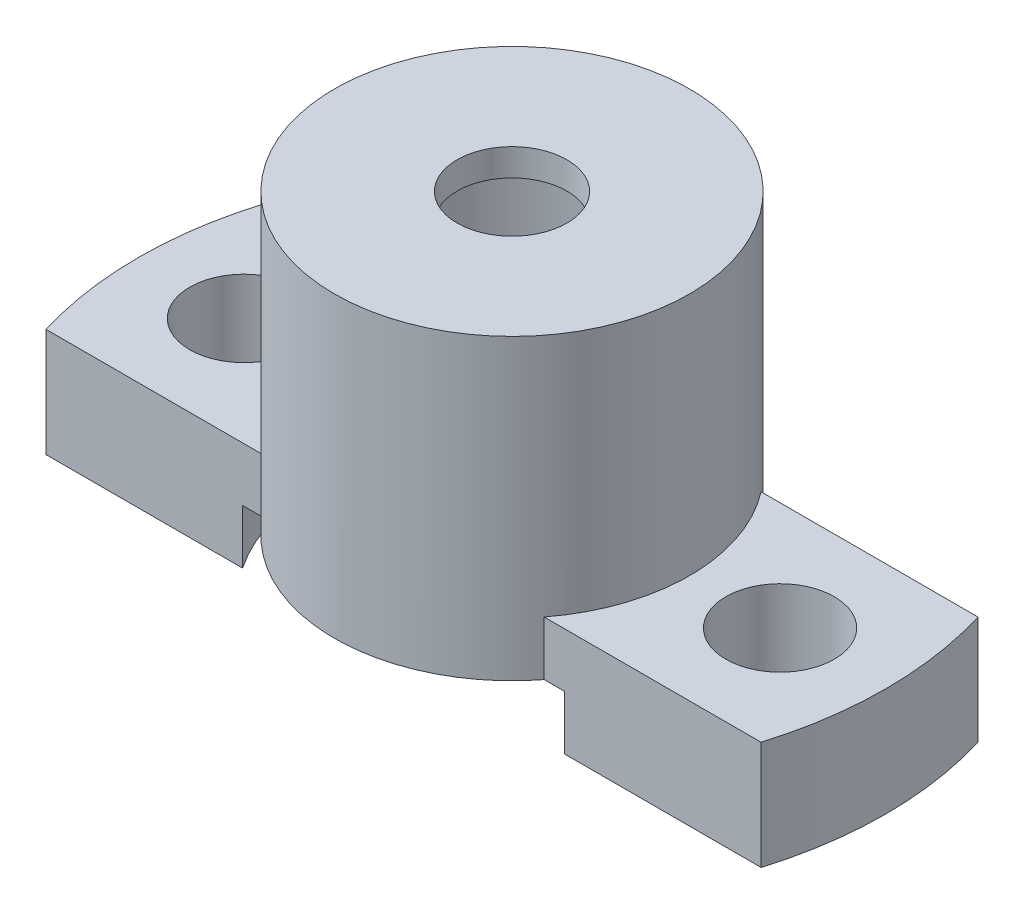
from build123d import *

# Parameters (mm, degrees)
SKETCH5_R                             = 6.55
SKETCH5_R_2                           = 2.025
EXT_TOPMAGNETROOM_DEPTH               = 1
EXT_MAGNETROOM_START                  = 4
SKETCH7_R                             = 6.55
SKETCH7_R_2                           = 5.05
EXT_MAGNETROOM_DEPTH                  = 4
BOTTOM_ARMS_FIXING_WITH_SUPPORT_DEPTH = 2
BOTTOM_START                          = 2
BOTTOM_FIXING_ARMS_END_DEPTH          = 2
ESQUISSE1_R                           = 2
EXT_HOLEMOUNTED_DEPTH                 = 16.773179512
SKETCH10_R                            = 6.55
SKETCH10_R_2                          = 5.05
CHAMBER_DEPTH                         = 5
SKETCH11_R                            = 6.55
SKETCH11_R_2                          = 2.025
BOSS_EXTRUDE4_DEPTH                   = 1
SKETCH13_R                            = 5.2
CUT_EXTRUDE2_DEPTH                    = 4


with BuildPart() as part:
    # Sketch5 → Ext_TopMagnetRoom (new body)
    with BuildSketch(Plane(origin=(0, 0, 0), x_dir=(-1, 0, 0), z_dir=(0, 1, 0))):
        with Locations(Location((0, 0, 0), (0, 0, 90))):
            Circle(SKETCH5_R)
        with Locations(Location((0, 0, 0), (0, 0, 90))):
            Circle(SKETCH5_R_2, mode=Mode.SUBTRACT)
    extrude(amount=EXT_TOPMAGNETROOM_DEPTH)

    # Sketch7 → Ext_MagnetRoom (add)
    with BuildSketch(Plane.XZ.offset(EXT_MAGNETROOM_START)):
        with Locations(Location((0, 0, 0), (0, 0, 270))):
            Circle(SKETCH7_R)
        with Locations(Location((0, 0, 0), (0, 0, 270))):
            Circle(SKETCH7_R_2, mode=Mode.SUBTRACT)
    extrude(amount=-EXT_MAGNETROOM_DEPTH)

    # Sketch6 → Bottom-arms fixing with support (add)
    with BuildSketch(Plane.XZ.offset(4)):
        with BuildLine():
            Line((13.186761996, -4), (5.186761996, -4))
            ThreePointArc((5.186761996, -4), (6.55, 0), (5.186761996, 4))
            Line((5.186761996, 4), (13.186761996, 4))
            ThreePointArc((13.186761996, 4), (13.780083161, 0), (13.186761996, -4))
        make_face()
        with BuildLine():
            Line((-13.186761996, -4), (-5.186761996, -4))
            ThreePointArc((-5.186761996, -4), (-6.55, 0), (-5.186761996, 4))
            Line((-5.186761996, 4), (-13.186761996, 4))
            ThreePointArc((-13.186761996, 4), (-13.780083161, 0), (-13.186761996, -4))
        make_face()
    extrude(amount=-BOTTOM_ARMS_FIXING_WITH_SUPPORT_DEPTH)

    # Sketch9 → Bottom- Fixing arms End (add)
    with BuildSketch(Plane.XZ.offset(4).offset(BOTTOM_START)):
        with BuildLine():
            Line((13.186761996, 4), (5.936761996, 4))
            ThreePointArc((5.936761996, 4), (7.158571296, 0), (5.936761996, -4))
            Line((5.936761996, -4), (13.186761996, -4))
            ThreePointArc((13.186761996, -4), (13.780083161, 0), (13.186761996, 4))
        make_face()
        with BuildLine():
            Line((-13.186761996, -4), (-5.936761996, -4))
            ThreePointArc((-5.936761996, -4), (-7.158571296, 0), (-5.936761996, 4))
            Line((-5.936761996, 4), (-13.186761996, 4))
            ThreePointArc((-13.186761996, 4), (-13.780083161, 0), (-13.186761996, -4))
        make_face()
    extrude(amount=-BOTTOM_FIXING_ARMS_END_DEPTH)

    # Esquisse1 → Ext_HoleMounted (cut, through all)
    with BuildSketch(Plane(origin=(0, -2, 0), x_dir=(1, 0, 0), z_dir=(0, 1, 0))):
        with Locations(Location((-9.886761996, 0, 0), (0, 0, 270))):
            Circle(ESQUISSE1_R)
        with Locations(Location((9.886761996, 0, 0), (0, 0, 270))):
            Circle(ESQUISSE1_R)
    extrude(amount=-EXT_HOLEMOUNTED_DEPTH, mode=Mode.SUBTRACT)

    # Sketch10 → chamber (add)
    with BuildSketch(Plane(origin=(0, 1, 0), x_dir=(1, 0, 0), z_dir=(0, 1, 0))):
        with Locations(Location((0, 0, 0), (0, 0, 142.360804213))):
            Circle(SKETCH10_R)
        with Locations(Location((0, 0, 0), (0, 0, 90))):
            Circle(SKETCH10_R_2, mode=Mode.SUBTRACT)
    extrude(amount=CHAMBER_DEPTH)

    # Sketch11 → Boss-Extrude4 (add)
    with BuildSketch(Plane(origin=(0, 6, 0), x_dir=(1, 0, 0), z_dir=(0, 1, 0))):
        with Locations(Location((0, 0, 0), (0, 0, 142.360804213))):
            Circle(SKETCH11_R)
        with Locations(Location((0, 0, 0), (0, 0, 270))):
            Circle(SKETCH11_R_2, mode=Mode.SUBTRACT)
    extrude(amount=BOSS_EXTRUDE4_DEPTH)

    # Sketch13 → Cut-Extrude2 (cut)
    with BuildSketch(Plane.XZ.offset(4)):
        with Locations(Location((0, 0, 0), (0, 0, 270))):
            Circle(SKETCH13_R)
    extrude(amount=-CUT_EXTRUDE2_DEPTH, mode=Mode.SUBTRACT)


solid = part.part
